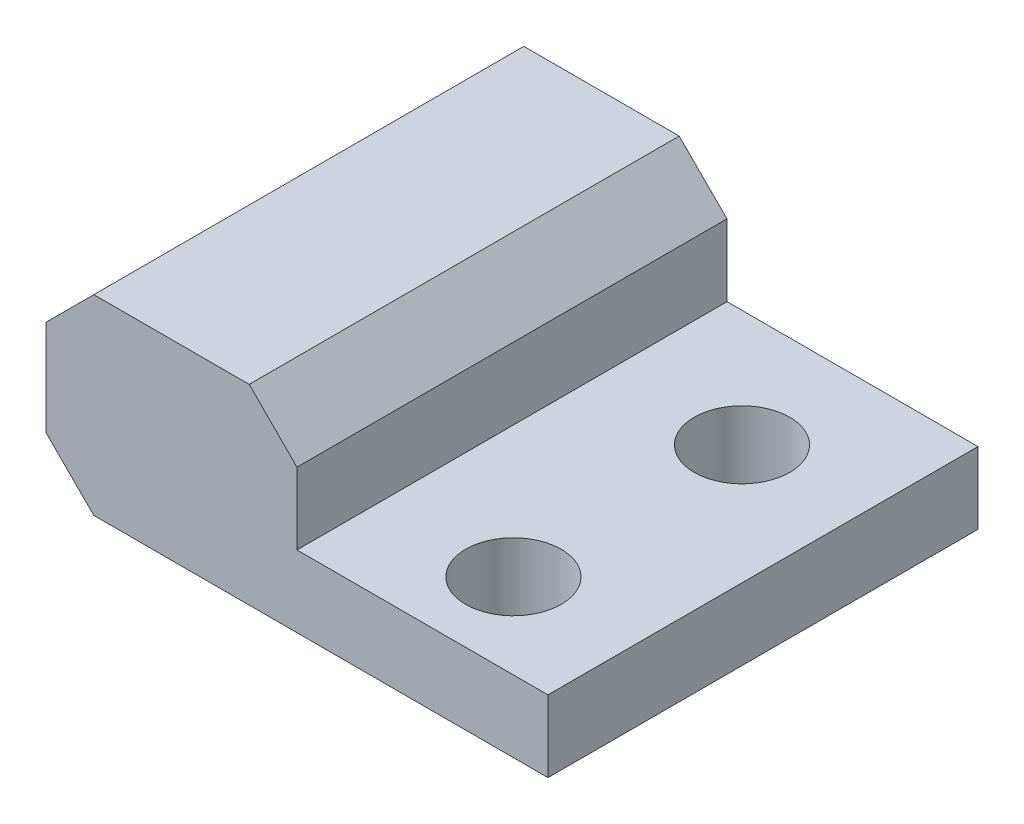
from build123d import *

# Parameters (mm, degrees)
SKETCH_1_W          = 21
SKETCH_1_H          = 17.990855805
EXTRUDE_1_DEPTH     = 8
SKETCH_2_W          = 10.499999995
SKETCH_2_H          = 17.994369167
CUT_EXTRUDE_1_DEPTH = 5
SKETCH_3_R          = 1.999999882
SKETCH_3_R_2        = 1.999999942
CUT_EXTRUDE_2_DEPTH = 22.671891763
SKETCH_4_R          = 2.6
CUT_EXTRUDE_3_DEPTH = 15
CHAMFER_1_SIZE      = 2


with BuildPart() as part:
    # Эскиз1 → Вытянуть1 (new body)
    with BuildSketch(Plane(origin=(0, 0, 0), x_dir=(1, 0, 0), z_dir=(0, 1, 0))):
        with Locations((-0.5, -8.995427903)):
            Rectangle(SKETCH_1_W, SKETCH_1_H)
    extrude(amount=EXTRUDE_1_DEPTH)

    # Эскиз2 → Вырез-Вытянуть1 (cut)
    with BuildSketch(Plane(origin=(0, 8, 0), x_dir=(1, 0, 0), z_dir=(0, 1, 0))):
        with Locations((4.749999998, -8.993671222)):
            Rectangle(SKETCH_2_W, SKETCH_2_H)
    extrude(amount=-CUT_EXTRUDE_1_DEPTH, mode=Mode.SUBTRACT)

    # Эскиз3 → Вырез-Вытянуть2 (cut, through all)
    with BuildSketch(Plane(origin=(0, 3, 0), x_dir=(1, 0, 0), z_dir=(0, 1, 0))):
        with Locations(Location((4.999999995, -14.436118586, 0), (0, 0, 270))):
            Circle(SKETCH_3_R)
        with Locations(Location((4.999999995, -4.873583798, 0), (0, 0, 270))):
            Circle(SKETCH_3_R_2)
    extrude(amount=-CUT_EXTRUDE_2_DEPTH, mode=Mode.SUBTRACT)

    # Эскиз4 → Вырез-Вытянуть3 (cut)
    with BuildSketch(Plane.XY):
        with Locations((-5.500000032, 4.090743194)):
            Circle(SKETCH_4_R)
    extrude(amount=CUT_EXTRUDE_3_DEPTH, mode=Mode.SUBTRACT)

    # Фаска1
    chamfer_1_edges = [part.edges().sort_by_distance(p)[0] for p in [
        (-0.5, 8, 8.995427902),
        (-11, 8, 8.995427902),
        (-11, 0, 8.995427902),
    ]]
    chamfer(chamfer_1_edges, length=CHAMFER_1_SIZE)


solid = part.part
